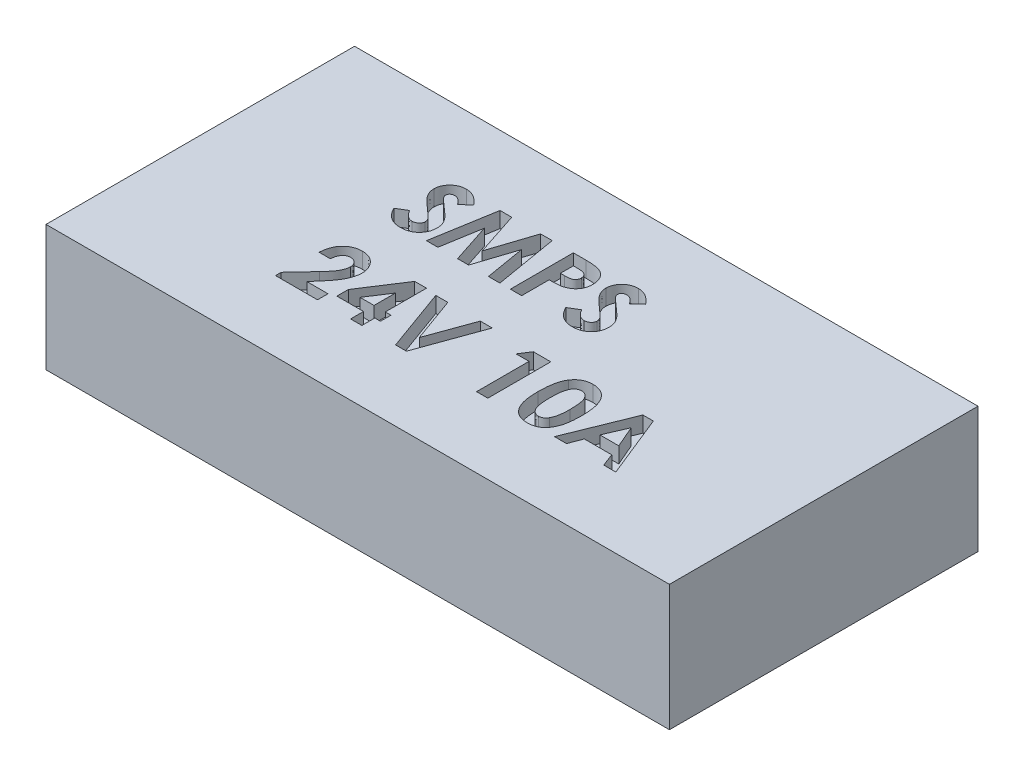
from build123d import *

# Parameters (mm, degrees)
SKIZZE1_W                       = 198
SKIZZE1_H                       = 98
AUFSATZ_LINEAR_AUSTRAGEN1_DEPTH = 40
SCHNITT_LINEAR_AUSTRAGEN1_DEPTH = 5


with BuildPart() as part:
    # Skizze1 → Aufsatz-Linear austragen1 (new body)
    with BuildSketch(Plane(origin=(0, 0, 0), x_dir=(1, 0, 0), z_dir=(0, 1, 0))):
        Rectangle(SKIZZE1_W, SKIZZE1_H)
    extrude(amount=AUFSATZ_LINEAR_AUSTRAGEN1_DEPTH)

    # Skizze2 → Schnitt-Linear austragen1 (cut)
    # profile 1 of 10: a face of its own
    with BuildSketch(Plane(origin=(0, 40, 0), x_dir=(1, 0, 0), z_dir=(0, 1, 0))):
        with BuildLine():
            Line((-36.421271155, 24.25850865), (-39.105566026, 21.802579163))
            add(Edge.make_bspline(
                [(-39.105566026, 21.802579163), (-39.220549709, 21.964775601), (-39.441302344, 22.276170142), (-39.79911934, 22.693134772), (-40.155320609, 23.048836632), (-40.513206139, 23.341789763), (-40.875948091, 23.570214258), (-41.242916798, 23.731941323), (-41.612031812, 23.834752754), (-41.860020124, 23.84755525), (-41.982168591, 23.853861214)],
                knots=[0, 0, 0, 0, 1.299362458, 2.494594718, 3.587462134, 4.587049575, 5.512617175, 6.380583204, 7.202344345, 8, 8, 8, 8], degree=3))
            add(Edge.make_bspline(
                [(-41.982168591, 23.853861214), (-42.096105177, 23.849865466), (-42.31608679, 23.842150727), (-42.6296869, 23.76546679), (-42.908105543, 23.633121577), (-43.151070996, 23.460069076), (-43.343535482, 23.251580934), (-43.497203448, 23.032930479), (-43.583731426, 22.791589825), (-43.59512021, 22.625827329), (-43.600758334, 22.54376506)],
                knots=[0, 0, 0, 0, 1.185010067, 2.2879431, 3.333075148, 4.379039566, 5.372662701, 6.27520591, 7.14612461, 8, 8, 8, 8], degree=3))
            add(Edge.make_bspline(
                [(-43.600758334, 22.54376506), (-43.597225208, 22.460519417), (-43.590109982, 22.292874261), (-43.521386589, 22.047169405), (-43.417800812, 21.807087159), (-43.318820373, 21.660937672), (-43.268226283, 21.586233009)],
                knots=[0, 0, 0, 0, 0.967525499, 1.948461899, 2.951351359, 4, 4, 4, 4], degree=3))
            add(Edge.make_bspline(
                [(-43.268226283, 21.586233009), (-43.222230782, 21.528165857), (-43.116355214, 21.394502941), (-42.914472191, 21.182801717), (-42.660949512, 20.923449187), (-42.346031091, 20.625363725), (-41.982790059, 20.277825012), (-41.554389724, 19.894494927), (-41.073161316, 19.463502181), (-40.731115313, 19.163374441), (-40.551880129, 19.006104804)],
                knots=[0, 0, 0, 0, 0.473873513, 1.090794244, 1.870441696, 2.795289791, 3.865433203, 5.087734844, 6.473946851, 8, 8, 8, 8], degree=3))
            add(Edge.make_bspline(
                [(-40.551880129, 19.006104804), (-40.383642126, 18.860503299), (-40.06436135, 18.584181891), (-39.610088208, 18.19198802), (-39.210857776, 17.839140756), (-38.860854175, 17.530935584), (-38.565383119, 17.264138724), (-38.323202448, 17.037474891), (-38.131354334, 16.855356813), (-38.022299915, 16.745357383), (-37.975758334, 16.698412496)],
                knots=[0, 0, 0, 0, 1.543621617, 2.929473131, 4.163658386, 5.240097082, 6.164993805, 6.925417477, 7.541396219, 8, 8, 8, 8], degree=3))
            add(Edge.make_bspline(
                [(-37.975758334, 16.698412496), (-37.79918928, 16.507326964), (-37.45976155, 16.139993465), (-37.018625156, 15.570742066), (-36.655555635, 15.015036627), (-36.374678169, 14.46242065), (-36.162548209, 13.904920986), (-36.012993778, 13.328864986), (-35.923424633, 12.728233226), (-35.913480367, 12.318375372), (-35.908450642, 12.111072753)],
                knots=[0, 0, 0, 0, 1.206664779, 2.319633467, 3.337109185, 4.282041471, 5.190008762, 6.099243693, 7.03861361, 8, 8, 8, 8], degree=3))
            add(Edge.make_bspline(
                [(-35.908450642, 12.111072753), (-35.912030672, 11.909081773), (-35.919054823, 11.512767953), (-36.00508721, 10.932821711), (-36.127764344, 10.377787988), (-36.317444714, 9.853706334), (-36.548626026, 9.35197411), (-36.838445189, 8.880406708), (-37.178798056, 8.434231673), (-37.568894701, 8.02142493), (-38.000387912, 7.646831422), (-38.46320539, 7.313359435), (-38.961872795, 7.038035833), (-39.492129594, 6.811326485), (-40.05369195, 6.636711914), (-40.645890875, 6.507655472), (-41.269632177, 6.43019783), (-41.696155467, 6.422100552), (-41.914059616, 6.417963778)],
                knots=[0, 0, 0, 0, 1.043214005, 2.046824704, 3.02475056, 3.976699089, 4.921714032, 5.875962561, 6.831408892, 7.817874052, 8.806269674, 9.781291748, 10.760897367, 11.74438705, 12.757449933, 13.795994037, 14.874007457, 16, 16, 16, 16], degree=3))
            add(Edge.make_bspline(
                [(-41.914059616, 6.417963778), (-42.085112518, 6.420998371), (-42.423895362, 6.427008604), (-42.923210056, 6.476077157), (-43.405354837, 6.55526858), (-43.869786613, 6.668773546), (-44.318597731, 6.812599732), (-44.751806622, 6.988277909), (-45.166422702, 7.198531023), (-45.565583153, 7.439035433), (-45.947347562, 7.718292733), (-46.31654319, 8.030593599), (-46.669502836, 8.380741358), (-47.007921693, 8.767907925), (-47.329634463, 9.193189661), (-47.645171959, 9.650663733), (-47.940510746, 10.148820236), (-48.122954652, 10.498281053), (-48.21614295, 10.676777881)],
                knots=[0, 0, 0, 0, 1.016823716, 2.013894106, 2.979844003, 3.91962641, 4.853723003, 5.779685073, 6.695824784, 7.614987388, 8.547259901, 9.504950863, 10.487499108, 11.500346958, 12.559593716, 13.656357062, 14.802919212, 16, 16, 16, 16], degree=3))
            Line((-48.21614295, 10.676777881), (-45.059091667, 12.571809932))
            add(Edge.make_bspline(
                [(-45.059091667, 12.571809932), (-44.942527035, 12.36919271), (-44.719062673, 11.98075818), (-44.34038142, 11.458847157), (-43.952441809, 11.011916757), (-43.546275023, 10.647866506), (-43.126819899, 10.361828581), (-42.69205037, 10.157406037), (-42.241660976, 10.030868713), (-41.934876182, 10.015415583), (-41.781848078, 10.007707368)],
                knots=[0, 0, 0, 0, 1.283663364, 2.460892379, 3.537111102, 4.529833553, 5.449777664, 6.316464042, 7.160231139, 8, 8, 8, 8], degree=3))
            add(Edge.make_bspline(
                [(-41.781848078, 10.007707368), (-41.626196587, 10.014002314), (-41.324210025, 10.026215427), (-40.893162851, 10.139024268), (-40.497962481, 10.316142424), (-40.1563542, 10.568865608), (-39.867101846, 10.860546573), (-39.653617005, 11.185054984), (-39.519504389, 11.536165252), (-39.505325434, 11.780069539), (-39.498194232, 11.902739419)],
                knots=[0, 0, 0, 0, 1.13588714, 2.203786484, 3.234766741, 4.283437687, 5.291419208, 6.222934724, 7.106237994, 8, 8, 8, 8], degree=3))
            add(Edge.make_bspline(
                [(-39.498194232, 11.902739419), (-39.504779605, 12.016863781), (-39.51815716, 12.248696496), (-39.616692107, 12.593394465), (-39.770732285, 12.937935672), (-39.952972678, 13.220537691), (-40.138425097, 13.457152701), (-40.315759439, 13.662168904), (-40.531705756, 13.888675917), (-40.785716505, 14.136958667), (-41.07443554, 14.409202852), (-41.398106071, 14.705381812), (-41.760434466, 15.022886564), (-42.01652889, 15.239167664), (-42.150437821, 15.35225865)],
                knots=[0, 0, 0, 0, 0.916159276, 1.861089862, 2.860218735, 3.940849679, 4.552606315, 5.27541173, 6.11797699, 7.06649574, 8.129236253, 9.306560635, 10.591630461, 12, 12, 12, 12], degree=3))
            add(Edge.make_bspline(
                [(-42.150437821, 15.35225865), (-42.405004029, 15.567646073), (-42.893593634, 15.98103973), (-43.584032734, 16.591609149), (-44.206180183, 17.162242216), (-44.75466245, 17.699993205), (-45.236468046, 18.1949311), (-45.648333974, 18.651075976), (-45.9857357, 19.071946369), (-46.340778264, 19.570439184), (-46.678139686, 20.177886932), (-46.969715689, 20.908716991), (-47.158877893, 21.639454319), (-47.180070887, 22.130031113), (-47.190501924, 22.371489419)],
                knots=[0, 0, 0, 0, 1.345494975, 2.582412109, 3.71882943, 4.751509156, 5.681369928, 6.505683931, 7.230279997, 7.856715994, 8.973648664, 10.023341002, 11.027102913, 12, 12, 12, 12], degree=3))
            add(Edge.make_bspline(
                [(-47.190501924, 22.371489419), (-47.18616367, 22.54271869), (-47.177616843, 22.880058747), (-47.10137783, 23.376068148), (-46.98743572, 23.854675544), (-46.821959064, 24.314134757), (-46.607190346, 24.753870295), (-46.34636208, 25.176034849), (-46.035424098, 25.576742913), (-45.685017983, 25.955728844), (-45.298960158, 26.302078857), (-44.886408312, 26.607767447), (-44.449697523, 26.865956476), (-43.991499368, 27.080143023), (-43.508974583, 27.244089218), (-43.005677907, 27.360302453), (-42.480887451, 27.429422379), (-42.123936311, 27.438818431), (-41.942104488, 27.443604804)],
                knots=[0, 0, 0, 0, 1.010766082, 1.991317756, 2.957454644, 3.913069143, 4.869106762, 5.843196583, 6.838735724, 7.860187025, 8.887984031, 9.89767229, 10.887916223, 11.879572884, 12.879850636, 13.892031539, 14.926195476, 16, 16, 16, 16], degree=3))
            add(Edge.make_bspline(
                [(-41.942104488, 27.443604804), (-41.706459444, 27.434984406), (-41.237029457, 27.417811657), (-40.542963681, 27.283526371), (-39.86502925, 27.072348613), (-39.31873698, 26.817585882), (-38.884062418, 26.570797104), (-38.55092497, 26.343585085), (-38.211939686, 26.083301505), (-37.864372858, 25.789126142), (-37.514682818, 25.455516346), (-37.152926204, 25.09041396), (-36.784032393, 24.690663647), (-36.544309905, 24.405083877), (-36.421271155, 24.25850865)],
                knots=[0, 0, 0, 0, 1.282922637, 2.555718331, 3.837320111, 5.142675274, 5.830281639, 6.55870424, 7.337177975, 8.157850921, 9.037902056, 9.96903443, 10.957596896, 12, 12, 12, 12], degree=3))
        make_face()
    # profile 2 of 10: a face of its own
    with BuildSketch(Plane(origin=(0, 40, 0), x_dir=(1, 0, 0), z_dir=(0, 1, 0))):
        Polygon((-30.736175001, 26.930784291), (-27.010213462, 26.930784291), (-22.44691218, 12.980463778), (-17.851559616, 26.930784291), (-14.16165577, 26.930784291), (-10.780245514, 6.930784291), (-14.414059616, 6.930784291), (-16.549476283, 19.56299583), (-20.708130129, 6.930784291), (-24.209732693, 6.930784291), (-28.344348078, 19.56299583), (-30.475758334, 6.930784291), (-34.113578847, 6.930784291), align=None)
    # profile 3 of 10: a face of its own
    with BuildSketch(Plane(origin=(0, 40, 0), x_dir=(1, 0, 0), z_dir=(0, 1, 0))):
        with BuildLine():
            Line((-7.44691218, 26.930784291), (-3.440501924, 26.930784291))
            add(Edge.make_bspline(
                [(-3.440501924, 26.930784291), (-3.178728275, 26.929612537), (-2.673712036, 26.927351976), (-1.945437069, 26.899939677), (-1.273567754, 26.850815167), (-0.658258451, 26.790105042), (-0.099762161, 26.704991809), (0.402620522, 26.607416151), (0.848993853, 26.4885406), (1.244391357, 26.347436969), (1.599247844, 26.181081301), (1.935056533, 26.003900641), (2.24422811, 25.792441771), (2.542367398, 25.569494831), (2.81242926, 25.313761786), (3.071261773, 25.042262041), (3.307902672, 24.744228139), (3.523448465, 24.423267701), (3.718981712, 24.085310702), (3.889812637, 23.729752977), (4.028381117, 23.356031892), (4.144622841, 22.966564997), (4.237989327, 22.561369267), (4.300137032, 22.137952711), (4.34235088, 21.699271785), (4.346075669, 21.400705271), (4.347959615, 21.249694548)],
                knots=[0, 0, 0, 0, 1.698747864, 3.27724071, 4.728299578, 6.070144658, 7.288476769, 8.393259625, 9.389771311, 10.283485332, 11.113357557, 11.931608583, 12.74405601, 13.541433047, 14.344816069, 15.154114104, 15.974336324, 16.810834471, 17.661136416, 18.50621059, 19.367396281, 20.244825668, 21.142564693, 22.063065223, 23.020325768, 24, 24, 24, 24], degree=3))
            add(Edge.make_bspline(
                [(4.347959615, 21.249694548), (4.345233781, 21.08263498), (4.339877183, 20.754342401), (4.287365261, 20.273105758), (4.197658308, 19.814290188), (4.080416012, 19.37402642), (3.916929968, 18.959557766), (3.73015484, 18.560994879), (3.50036219, 18.189512239), (3.237787351, 17.840463044), (2.951025671, 17.51100936), (2.63326944, 17.21066354), (2.290575228, 16.937378135), (1.924926771, 16.688289094), (1.534951312, 16.463898885), (1.12093024, 16.262106332), (0.680036383, 16.089365387), (0.373011166, 15.999023271), (0.21735064, 15.953220189)],
                knots=[0, 0, 0, 0, 1.102006807, 2.165578795, 3.188629044, 4.184801286, 5.166646146, 6.124351954, 7.085497154, 8.042432466, 9.003981491, 9.963833307, 10.922997304, 11.89326795, 12.880200226, 13.889073926, 14.929769137, 16, 16, 16, 16], degree=3))
            add(Edge.make_bspline(
                [(0.21735064, 15.953220189), (0.114823664, 15.927711311), (-0.107282783, 15.872450867), (-0.474807948, 15.816347647), (-0.898342113, 15.764764186), (-1.37925484, 15.720434446), (-1.917823386, 15.690300552), (-2.513526278, 15.666767321), (-3.166633477, 15.649656231), (-3.620778397, 15.649049055), (-3.857168591, 15.648733009)],
                knots=[0, 0, 0, 0, 0.618981996, 1.340914327, 2.176866532, 3.120127938, 4.170906482, 5.338178032, 6.614476169, 8, 8, 8, 8], degree=3))
            Line((-3.857168591, 15.648733009), (-3.857168591, 6.930784291))
            Line((-3.857168591, 6.930784291), (-7.44691218, 6.930784291))
            Line((-7.44691218, 6.930784291), (-7.44691218, 26.930784291))
        make_face()
        with BuildLine():
            Line((-3.857168591, 19.238476599), (-2.587136539, 19.238476599))
            add(Edge.make_bspline(
                [(-2.587136539, 19.238476599), (-2.356034157, 19.239941967), (-1.930802339, 19.242638267), (-1.35008584, 19.281628329), (-0.883410891, 19.341174029), (-0.514729015, 19.426576334), (-0.223619753, 19.556185641), (0.027443759, 19.706119202), (0.242787344, 19.895706074), (0.429243192, 20.112341514), (0.578309024, 20.361266492), (0.681678414, 20.63842775), (0.748825138, 20.93800183), (0.755026761, 21.146485562), (0.758216025, 21.253700958)],
                knots=[0, 0, 0, 0, 1.8619151, 3.425951444, 4.686033666, 5.651700536, 6.461346321, 7.243864085, 7.999046032, 8.762387399, 9.539336099, 10.322741239, 11.137448474, 12, 12, 12, 12], degree=3))
            add(Edge.make_bspline(
                [(0.758216025, 21.253700958), (0.755059567, 21.347373652), (0.748935281, 21.529121202), (0.703944607, 21.791427997), (0.632242413, 22.035952041), (0.528348692, 22.260139605), (0.39403871, 22.463609758), (0.230287663, 22.646282345), (0.039196798, 22.812069456), (-0.108336523, 22.899823106), (-0.183290385, 22.944406086)],
                knots=[0, 0, 0, 0, 1.102301479, 2.1387299, 3.123554645, 4.094223062, 5.036071848, 5.982632524, 6.975082478, 8, 8, 8, 8], degree=3))
            add(Edge.make_bspline(
                [(-0.183290385, 22.944406086), (-0.246780634, 22.976514925), (-0.381202501, 23.044495918), (-0.610135972, 23.123528792), (-0.874321702, 23.190201728), (-1.175543242, 23.245539621), (-1.512598933, 23.288487573), (-1.885428638, 23.321332012), (-2.294581012, 23.33454004), (-2.579122006, 23.338814048), (-2.727360898, 23.341040701)],
                knots=[0, 0, 0, 0, 0.656809284, 1.390599849, 2.23162475, 3.173112763, 4.218524733, 5.370385145, 6.63003504, 8, 8, 8, 8], degree=3))
            Line((-2.727360898, 23.341040701), (-3.857168591, 23.341040701))
            Line((-3.857168591, 23.341040701), (-3.857168591, 19.238476599))
        make_face(mode=Mode.SUBTRACT)
    # profile 4 of 10: a face of its own
    with BuildSketch(Plane(origin=(0, 40, 0), x_dir=(1, 0, 0), z_dir=(0, 1, 0))):
        with BuildLine():
            Line((18.194113461, 24.25850865), (15.509818589, 21.802579163))
            add(Edge.make_bspline(
                [(15.509818589, 21.802579163), (15.394834907, 21.964775601), (15.174082271, 22.276170142), (14.816265275, 22.693134772), (14.460064006, 23.048836632), (14.102178476, 23.341789763), (13.739436524, 23.570214258), (13.372467817, 23.731941323), (13.003352803, 23.834752754), (12.755364492, 23.84755525), (12.633216025, 23.853861214)],
                knots=[0, 0, 0, 0, 1.299362458, 2.494594718, 3.587462134, 4.587049575, 5.512617175, 6.380583204, 7.202344345, 8, 8, 8, 8], degree=3))
            add(Edge.make_bspline(
                [(12.633216025, 23.853861214), (12.519279439, 23.849865466), (12.299297825, 23.842150727), (11.985697716, 23.76546679), (11.707279072, 23.633121577), (11.464313619, 23.460069076), (11.271849134, 23.251580934), (11.118181167, 23.032930479), (11.031653189, 22.791589825), (11.020264405, 22.625827329), (11.014626281, 22.54376506)],
                knots=[0, 0, 0, 0, 1.185010067, 2.2879431, 3.333075148, 4.379039566, 5.372662701, 6.27520591, 7.14612461, 8, 8, 8, 8], degree=3))
            add(Edge.make_bspline(
                [(11.014626281, 22.54376506), (11.018159408, 22.460519417), (11.025274633, 22.292874261), (11.093998027, 22.047169405), (11.197583804, 21.807087159), (11.296564243, 21.660937672), (11.347158333, 21.586233009)],
                knots=[0, 0, 0, 0, 0.967525499, 1.948461899, 2.951351359, 4, 4, 4, 4], degree=3))
            add(Edge.make_bspline(
                [(11.347158333, 21.586233009), (11.393153833, 21.528165857), (11.499029401, 21.394502941), (11.700912425, 21.182801717), (11.954435104, 20.923449187), (12.269353524, 20.625363725), (12.632594556, 20.277825012), (13.060994891, 19.894494927), (13.542223299, 19.463502181), (13.884269303, 19.163374441), (14.063504486, 19.006104804)],
                knots=[0, 0, 0, 0, 0.473873513, 1.090794244, 1.870441696, 2.795289791, 3.865433203, 5.087734844, 6.473946851, 8, 8, 8, 8], degree=3))
            add(Edge.make_bspline(
                [(14.063504486, 19.006104804), (14.231742489, 18.860503299), (14.551023265, 18.584181891), (15.005296407, 18.19198802), (15.40452684, 17.839140756), (15.754530441, 17.530935584), (16.050001496, 17.264138724), (16.292182167, 17.037474891), (16.484030281, 16.855356813), (16.593084701, 16.745357383), (16.639626281, 16.698412496)],
                knots=[0, 0, 0, 0, 1.543621617, 2.929473131, 4.163658386, 5.240097082, 6.164993805, 6.925417477, 7.541396219, 8, 8, 8, 8], degree=3))
            add(Edge.make_bspline(
                [(16.639626281, 16.698412496), (16.816195335, 16.507326964), (17.155623066, 16.139993465), (17.596759459, 15.570742066), (17.95982898, 15.015036627), (18.240706447, 14.46242065), (18.452836406, 13.904920986), (18.602390838, 13.328864986), (18.691959982, 12.728233226), (18.701904248, 12.318375372), (18.706933974, 12.111072753)],
                knots=[0, 0, 0, 0, 1.206664779, 2.319633467, 3.337109185, 4.282041471, 5.190008762, 6.099243693, 7.03861361, 8, 8, 8, 8], degree=3))
            add(Edge.make_bspline(
                [(18.706933974, 12.111072753), (18.703353944, 11.909081773), (18.696329792, 11.512767953), (18.610297406, 10.932821711), (18.487620272, 10.377787988), (18.297939902, 9.853706334), (18.06675859, 9.35197411), (17.776939426, 8.880406708), (17.436586559, 8.434231673), (17.046489914, 8.02142493), (16.614996703, 7.646831422), (16.152179226, 7.313359435), (15.65351182, 7.038035833), (15.123255022, 6.811326485), (14.561692665, 6.636711914), (13.96949374, 6.507655472), (13.345752439, 6.43019783), (12.919229148, 6.422100552), (12.701324999, 6.417963778)],
                knots=[0, 0, 0, 0, 1.043214005, 2.046824704, 3.02475056, 3.976699089, 4.921714032, 5.875962561, 6.831408892, 7.817874052, 8.806269674, 9.781291748, 10.760897367, 11.74438705, 12.757449933, 13.795994037, 14.874007457, 16, 16, 16, 16], degree=3))
            add(Edge.make_bspline(
                [(12.701324999, 6.417963778), (12.530272098, 6.420998371), (12.191489254, 6.427008604), (11.69217456, 6.476077157), (11.210029778, 6.55526858), (10.745598002, 6.668773546), (10.296786884, 6.812599732), (9.863577993, 6.988277909), (9.448961913, 7.198531023), (9.049801462, 7.439035433), (8.668037053, 7.718292733), (8.298841425, 8.030593599), (7.945881779, 8.380741358), (7.607462922, 8.767907925), (7.285750152, 9.193189661), (6.970212656, 9.650663733), (6.674873869, 10.148820236), (6.492429963, 10.498281053), (6.399241666, 10.676777881)],
                knots=[0, 0, 0, 0, 1.016823716, 2.013894106, 2.979844003, 3.91962641, 4.853723003, 5.779685073, 6.695824784, 7.614987388, 8.547259901, 9.504950863, 10.487499108, 11.500346958, 12.559593716, 13.656357062, 14.802919212, 16, 16, 16, 16], degree=3))
            Line((6.399241666, 10.676777881), (9.556292948, 12.571809932))
            add(Edge.make_bspline(
                [(9.556292948, 12.571809932), (9.67285758, 12.36919271), (9.896321942, 11.98075818), (10.275003195, 11.458847157), (10.662942806, 11.011916757), (11.069109592, 10.647866506), (11.488564717, 10.361828581), (11.923334245, 10.157406037), (12.373723639, 10.030868713), (12.680508433, 10.015415583), (12.833536538, 10.007707368)],
                knots=[0, 0, 0, 0, 1.283663364, 2.460892379, 3.537111102, 4.529833553, 5.449777664, 6.316464042, 7.160231139, 8, 8, 8, 8], degree=3))
            add(Edge.make_bspline(
                [(12.833536538, 10.007707368), (12.989188029, 10.014002314), (13.291174591, 10.026215427), (13.722221764, 10.139024268), (14.117422134, 10.316142424), (14.459030416, 10.568865608), (14.74828277, 10.860546573), (14.96176761, 11.185054984), (15.095880227, 11.536165252), (15.110059182, 11.780069539), (15.117190384, 11.902739419)],
                knots=[0, 0, 0, 0, 1.13588714, 2.203786484, 3.234766741, 4.283437687, 5.291419208, 6.222934724, 7.106237994, 8, 8, 8, 8], degree=3))
            add(Edge.make_bspline(
                [(15.117190384, 11.902739419), (15.110605011, 12.016863781), (15.097227456, 12.248696496), (14.998692508, 12.593394465), (14.84465233, 12.937935672), (14.662411938, 13.220537691), (14.476959518, 13.457152701), (14.299625177, 13.662168904), (14.083678859, 13.888675917), (13.82966811, 14.136958667), (13.540949075, 14.409202852), (13.217278545, 14.705381812), (12.85495015, 15.022886564), (12.598855725, 15.239167664), (12.464946794, 15.35225865)],
                knots=[0, 0, 0, 0, 0.916159276, 1.861089862, 2.860218735, 3.940849679, 4.552606315, 5.27541173, 6.11797699, 7.06649574, 8.129236253, 9.306560635, 10.591630461, 12, 12, 12, 12], degree=3))
            add(Edge.make_bspline(
                [(12.464946794, 15.35225865), (12.210380586, 15.567646073), (11.721790981, 15.98103973), (11.031351882, 16.591609149), (10.409204432, 17.162242216), (9.860722165, 17.699993205), (9.37891657, 18.1949311), (8.967050641, 18.651075976), (8.629648915, 19.071946369), (8.274606352, 19.570439184), (7.93724493, 20.177886932), (7.645668927, 20.908716991), (7.456506722, 21.639454319), (7.435313728, 22.130031113), (7.424882691, 22.371489419)],
                knots=[0, 0, 0, 0, 1.345494975, 2.582412109, 3.71882943, 4.751509156, 5.681369928, 6.505683931, 7.230279997, 7.856715994, 8.973648664, 10.023341002, 11.027102913, 12, 12, 12, 12], degree=3))
            add(Edge.make_bspline(
                [(7.424882691, 22.371489419), (7.429220946, 22.54271869), (7.437767772, 22.880058747), (7.514006786, 23.376068148), (7.627948896, 23.854675544), (7.793425551, 24.314134757), (8.008194269, 24.753870295), (8.269022535, 25.176034849), (8.579960518, 25.576742913), (8.930366633, 25.955728844), (9.316424457, 26.302078857), (9.728976304, 26.607767447), (10.165687092, 26.865956476), (10.623885247, 27.080143023), (11.106410032, 27.244089218), (11.609706708, 27.360302453), (12.134497164, 27.429422379), (12.491448304, 27.438818431), (12.673280127, 27.443604804)],
                knots=[0, 0, 0, 0, 1.010766082, 1.991317756, 2.957454644, 3.913069143, 4.869106762, 5.843196583, 6.838735724, 7.860187025, 8.887984031, 9.89767229, 10.887916223, 11.879572884, 12.879850636, 13.892031539, 14.926195476, 16, 16, 16, 16], degree=3))
            add(Edge.make_bspline(
                [(12.673280127, 27.443604804), (12.908925171, 27.434984406), (13.378355158, 27.417811657), (14.072420934, 27.283526371), (14.750355366, 27.072348613), (15.296647635, 26.817585882), (15.731322197, 26.570797104), (16.064459645, 26.343585085), (16.40344493, 26.083301505), (16.751011757, 25.789126142), (17.100701798, 25.455516346), (17.462458412, 25.09041396), (17.831352223, 24.690663647), (18.071074711, 24.405083877), (18.194113461, 24.25850865)],
                knots=[0, 0, 0, 0, 1.282922637, 2.555718331, 3.837320111, 5.142675274, 5.830281639, 6.55870424, 7.337177975, 8.157850921, 9.037902056, 9.96903443, 10.957596896, 12, 12, 12, 12], degree=3))
        make_face()
    # profile 5 of 10: a face of its own
    with BuildSketch(Plane(origin=(0, 40, 0), x_dir=(1, 0, 0), z_dir=(0, 1, 0))):
        with BuildLine():
            Line((-44.369989103, -13.29998494), (-47.959732693, -13.29998494))
            add(Edge.make_bspline(
                [(-47.959732693, -13.29998494), (-47.944229141, -13.028439828), (-47.913936131, -12.497856984), (-47.793438195, -11.727168414), (-47.631975095, -10.998952464), (-47.416481154, -10.315756512), (-47.145698917, -9.67782881), (-46.826596309, -9.082994627), (-46.451020983, -8.534385779), (-46.026966417, -8.034647967), (-45.561631891, -7.586328565), (-45.064678207, -7.188820418), (-44.528503788, -6.860806699), (-43.962904981, -6.590881777), (-43.367978093, -6.375224306), (-42.738094184, -6.231039836), (-42.078707128, -6.1333967), (-41.627303293, -6.124852534), (-41.397232693, -6.12049776)],
                knots=[0, 0, 0, 0, 1.199038563, 2.342849363, 3.436047546, 4.486744587, 5.497670872, 6.488682221, 7.459191391, 8.424610317, 9.374430501, 10.305433194, 11.225809216, 12.140057399, 13.06607119, 14.010487599, 14.985989317, 16, 16, 16, 16], degree=3))
            add(Edge.make_bspline(
                [(-41.397232693, -6.12049776), (-41.114824296, -6.129309647), (-40.563496923, -6.146512514), (-39.762374518, -6.293258683), (-39.014213785, -6.538714327), (-38.319558565, -6.881680594), (-37.68432258, -7.317383286), (-37.108611169, -7.836887437), (-36.609834765, -8.451092519), (-36.184830977, -9.134442459), (-35.831703624, -9.858013872), (-35.584246685, -10.606216719), (-35.421595902, -11.359196729), (-35.404248189, -11.866215356), (-35.395630129, -12.118093914)],
                knots=[0, 0, 0, 0, 1.075374347, 2.099382735, 3.09057751, 4.06680945, 5.040638231, 6.016817125, 7.011024321, 8.044445721, 9.0776792, 10.070479129, 11.0414456, 12, 12, 12, 12], degree=3))
            add(Edge.make_bspline(
                [(-35.395630129, -12.118093914), (-35.398985546, -12.270447868), (-35.405739173, -12.577098744), (-35.452698034, -13.041136783), (-35.523145606, -13.513813778), (-35.629363375, -13.994724453), (-35.761825641, -14.484003615), (-35.922521516, -14.983115508), (-36.115178499, -15.489230351), (-36.336581536, -16.00804438), (-36.600715919, -16.541241981), (-36.908263694, -17.096815993), (-37.267387876, -17.674273579), (-37.673750696, -18.276875252), (-38.129325762, -18.903670616), (-38.636337041, -19.552771568), (-39.188944953, -20.226465332), (-39.581146335, -20.676791807), (-39.78264936, -20.908158017)],
                knots=[0, 0, 0, 0, 0.728284026, 1.46585585, 2.227944881, 3.01186502, 3.81876927, 4.650621989, 5.517437689, 6.406905708, 7.346299482, 8.360816762, 9.441613733, 10.596154504, 11.834900912, 13.145207542, 14.533280747, 16, 16, 16, 16], degree=3))
            Line((-39.78264936, -20.908158017), (-41.869989103, -23.29998494))
            Line((-41.869989103, -23.29998494), (-35.139219873, -23.29998494))
            Line((-35.139219873, -23.29998494), (-35.139219873, -26.633318273))
            Line((-35.139219873, -26.633318273), (-48.472553206, -26.633318273))
            Line((-48.472553206, -26.633318273), (-48.472553206, -24.814408017))
            Line((-48.472553206, -24.814408017), (-42.551078847, -18.512324683))
            add(Edge.make_bspline(
                [(-42.551078847, -18.512324683), (-42.379636947, -18.328490955), (-42.04760483, -17.972459541), (-41.575157344, -17.449589533), (-41.147634103, -16.953398375), (-40.77390015, -16.478602634), (-40.434342406, -16.040602751), (-40.144101725, -15.626196863), (-39.900522633, -15.239131348), (-39.636082981, -14.772397938), (-39.384952239, -14.215735292), (-39.154524584, -13.574437098), (-39.014062982, -12.961503719), (-38.994674839, -12.562103155), (-38.985373719, -12.37049776)],
                knots=[0, 0, 0, 0, 1.246127091, 2.413378631, 3.493388633, 4.492180848, 5.408488754, 6.240484944, 6.999099869, 7.674939598, 8.898438119, 10.020720584, 11.050475521, 12, 12, 12, 12], degree=3))
            add(Edge.make_bspline(
                [(-38.985373719, -12.37049776), (-38.992327942, -12.185134323), (-39.005802864, -11.825962945), (-39.15388134, -11.315043573), (-39.383289651, -10.852458236), (-39.70655836, -10.452029508), (-40.098138014, -10.12297067), (-40.550645086, -9.87822595), (-41.060390313, -9.737009369), (-41.41773143, -9.719334099), (-41.601559616, -9.71024135)],
                knots=[0, 0, 0, 0, 1.062038974, 2.057870785, 3.028805853, 4.01125022, 4.991535629, 5.949134679, 6.94496649, 8, 8, 8, 8], degree=3))
            add(Edge.make_bspline(
                [(-41.601559616, -9.71024135), (-41.696527599, -9.71360032), (-41.883487324, -9.720212993), (-42.158303506, -9.764231764), (-42.419810848, -9.841810254), (-42.670920071, -9.945754512), (-42.908951272, -10.083533372), (-43.133304061, -10.253367767), (-43.346342277, -10.450941821), (-43.547088842, -10.675637745), (-43.729794423, -10.926398461), (-43.892072852, -11.200933785), (-44.026250097, -11.499073303), (-44.144384621, -11.816881118), (-44.235495618, -12.157770746), (-44.301835727, -12.519702), (-44.352269682, -12.902086066), (-44.36397518, -13.164939154), (-44.369989103, -13.29998494)],
                knots=[0, 0, 0, 0, 0.903469896, 1.778625579, 2.63899355, 3.493148037, 4.358286772, 5.247621495, 6.164656832, 7.118446693, 8.109501108, 9.111810964, 10.146451449, 11.215617525, 12.33435995, 13.498009769, 14.714554818, 16, 16, 16, 16], degree=3))
        make_face()
    # profile 6 of 10: a face of its own
    with BuildSketch(Plane(origin=(0, 40, 0), x_dir=(1, 0, 0), z_dir=(0, 1, 0))):
        Polygon((-24.77864295, -6.12049776), (-21.03665577, -6.12049776), (-21.03665577, -19.197420837), (-19.241783975, -19.197420837), (-19.241783975, -22.53075417), (-21.03665577, -22.53075417), (-21.03665577, -26.633318273), (-24.62639936, -26.633318273), (-24.62639936, -22.53075417), (-33.087937821, -22.53075417), (-33.087937821, -18.896940068), align=None)
        Polygon((-24.62639936, -19.197420837), (-24.62639936, -12.390529811), (-29.053482693, -19.197420837), align=None, mode=Mode.SUBTRACT)
    # profile 7 of 10: a face of its own
    with BuildSketch(Plane(origin=(0, 40, 0), x_dir=(1, 0, 0), z_dir=(0, 1, 0))):
        Polygon((-17.575117309, -6.633318273), (-13.740982693, -6.633318273), (-8.600758334, -20.840049042), (-3.448514744, -6.633318273), (0.37360064, -6.633318273), (-6.878001924, -26.633318273), (-10.335533975, -26.633318273), align=None)
    # profile 8 of 10: a face of its own
    with BuildSketch(Plane(origin=(0, 40, 0), x_dir=(1, 0, 0), z_dir=(0, 1, 0))):
        Polygon((13.414466025, -6.633318273), (18.96334423, -6.633318273), (18.96334423, -26.633318273), (15.37360064, -26.633318273), (15.37360064, -9.966651606), (11.271036538, -9.966651606), align=None)
    # profile 9 of 10: a face of its own
    with BuildSketch(Plane(origin=(0, 40, 0), x_dir=(1, 0, 0), z_dir=(0, 1, 0))):
        with BuildLine():
            add(Edge.make_bspline(
                [(31.851966025, -6.12049776), (32.025724514, -6.123077254), (32.367380128, -6.128149228), (32.870574536, -6.183082836), (33.355289876, -6.266072198), (33.823422413, -6.381813419), (34.271602483, -6.534992803), (34.703092033, -6.718345899), (35.112755088, -6.941489955), (35.505816161, -7.193542628), (35.882123846, -7.478901984), (36.232633849, -7.804226385), (36.563747228, -8.162030101), (36.868296599, -8.557722484), (37.153026298, -8.987704291), (37.417000754, -9.452043704), (37.658199175, -9.953013354), (37.87932482, -10.491517279), (38.077056071, -11.075627421), (38.243604858, -11.712043778), (38.386448312, -12.400911684), (38.507018266, -13.143945838), (38.598149664, -13.942133909), (38.65957406, -14.794945621), (38.701726389, -15.700736878), (38.705166568, -16.322102237), (38.706933974, -16.641331093)],
                knots=[0, 0, 0, 0, 0.879237366, 1.728815576, 2.559023295, 3.367336655, 4.166867292, 4.954216142, 5.737608147, 6.525189134, 7.316157332, 8.124696809, 8.942788509, 9.781158001, 10.649253743, 11.551476218, 12.482711956, 13.461909668, 14.496590415, 15.601789533, 16.789733467, 18.056700938, 19.410929216, 20.8549011, 22.384193279, 24, 24, 24, 24], degree=3))
            add(Edge.make_bspline(
                [(38.706933974, -16.641331093), (38.705023886, -16.964553862), (38.70131262, -17.592569902), (38.661326345, -18.506645986), (38.592468091, -19.365649622), (38.503718603, -20.169491942), (38.382156081, -20.917748449), (38.23978947, -21.612356623), (38.07061176, -22.253064687), (37.866367305, -22.838428989), (37.646580138, -23.377878645), (37.404721936, -23.877871523), (37.145008253, -24.33976188), (36.873396138, -24.77051796), (36.574994815, -25.157441293), (36.26432832, -25.513689296), (35.927869677, -25.825692025), (35.579785095, -26.109528701), (35.20732283, -26.354820549), (34.814323987, -26.569348755), (34.393782078, -26.74335661), (33.953362866, -26.894699348), (33.485559319, -27.003347104), (32.997804769, -27.089555528), (32.484592566, -27.137199591), (32.135177027, -27.143110151), (31.956132691, -27.146138786)],
                knots=[0, 0, 0, 0, 1.643780988, 3.193836972, 4.651895693, 6.025988579, 7.305620092, 8.505800249, 9.631074763, 10.672816429, 11.65661981, 12.592235626, 13.49536222, 14.350718032, 15.179365177, 15.97804903, 16.751647189, 17.51006938, 18.259804725, 19.016521909, 19.783502495, 20.571750527, 21.382245291, 22.22305063, 23.089471752, 24, 24, 24, 24], degree=3))
            add(Edge.make_bspline(
                [(31.956132691, -27.146138786), (31.777093189, -27.14305173), (31.426357436, -27.137004234), (30.911757457, -27.089909782), (30.421418053, -27.002997872), (29.949913427, -26.893865231), (29.500525178, -26.743691471), (29.071098502, -26.564477426), (28.66493532, -26.351287769), (28.280911029, -26.105424414), (27.920336797, -25.82348682), (27.577609303, -25.508490627), (27.253486679, -25.161234269), (26.952899636, -24.777828186), (26.670925427, -24.363390052), (26.410504596, -23.913187183), (26.17179365, -23.427875065), (25.947325667, -22.906777222), (25.752291403, -22.338675015), (25.578719964, -21.718495363), (25.436534807, -21.041068559), (25.322179989, -20.306612232), (25.230879168, -19.51668236), (25.162961851, -18.670897666), (25.122753471, -17.768864205), (25.119081126, -17.148851676), (25.117190384, -16.829632376)],
                knots=[0, 0, 0, 0, 0.917216111, 1.796812873, 2.643793957, 3.46689424, 4.273913431, 5.068098542, 5.848489301, 6.620921603, 7.401012384, 8.190319798, 9.003608147, 9.831726257, 10.68377682, 11.569763213, 12.493818149, 13.453288342, 14.474581811, 15.568529029, 16.750744269, 18.018426408, 19.375425659, 20.823733699, 22.36466933, 24, 24, 24, 24], degree=3))
            add(Edge.make_bspline(
                [(25.117190384, -16.829632376), (25.120615286, -16.386102288), (25.127223678, -15.530305271), (25.21097008, -14.293927404), (25.333888558, -13.151110238), (25.514426684, -12.103765424), (25.737659581, -11.148013903), (26.023520929, -10.290151665), (26.348953279, -9.518308262), (26.62626345, -9.061063583), (26.759818589, -8.840850324)],
                knots=[0, 0, 0, 0, 1.288568992, 2.486310467, 3.599230591, 4.627010532, 5.572937695, 6.447898582, 7.252493626, 8, 8, 8, 8], degree=3))
            add(Edge.make_bspline(
                [(26.759818589, -8.840850324), (26.915110143, -8.624512887), (27.218735731, -8.201530569), (27.749633558, -7.646233851), (28.320014152, -7.171316906), (28.941592804, -6.78752753), (29.604538989, -6.484871196), (30.314544438, -6.271108437), (31.068987218, -6.146560292), (31.58707566, -6.129315002), (31.851966025, -6.12049776)],
                knots=[0, 0, 0, 0, 1.058512271, 2.069600068, 3.047294572, 4.004278952, 4.967380941, 5.939006123, 6.946246673, 8, 8, 8, 8], degree=3))
        make_face()
        with BuildLine():
            add(Edge.make_bspline(
                [(31.94010705, -9.71024135), (31.783027936, -9.717686588), (31.475069488, -9.732283206), (31.028207107, -9.8561879), (30.606843782, -10.047565381), (30.286323956, -10.277858258), (30.046418053, -10.498621598), (29.878794079, -10.69840524), (29.717147175, -10.921349387), (29.574372489, -11.17751436), (29.439555916, -11.457695851), (29.307799487, -11.763165714), (29.199793813, -12.101426951), (29.093681102, -12.46671893), (29.000716466, -12.869141002), (28.922832481, -13.311982524), (28.853249986, -13.798123337), (28.804715367, -14.327881861), (28.759466536, -14.90070384), (28.727030032, -15.517865298), (28.713469143, -16.179199739), (28.709158549, -16.634650953), (28.706933974, -16.869696478)],
                knots=[0, 0, 0, 0, 1.076674018, 2.110852608, 3.161083442, 4.239746716, 4.804137807, 5.395870207, 6.026861976, 6.692161227, 7.405688833, 8.16177676, 8.973626916, 9.841385931, 10.773283133, 11.807421078, 12.927755683, 14.143907515, 15.458935494, 16.872852025, 18.386167141, 20, 20, 20, 20], degree=3))
            add(Edge.make_bspline(
                [(28.706933974, -16.869696478), (28.710595355, -17.174209318), (28.717616327, -17.758135266), (28.754388893, -18.597841111), (28.828096451, -19.362041045), (28.919773771, -20.055914335), (29.048538311, -20.674961025), (29.196690249, -21.225037871), (29.379644719, -21.699132731), (29.591083861, -22.104102081), (29.825262239, -22.448608666), (30.079473169, -22.741440814), (30.34506168, -22.995019639), (30.630317654, -23.200998594), (30.934560556, -23.35885137), (31.255250516, -23.472392922), (31.592591328, -23.541896435), (31.823598839, -23.551534338), (31.94010705, -23.556395196)],
                knots=[0, 0, 0, 0, 1.771748488, 3.397459088, 4.888034009, 6.237357457, 7.467047327, 8.564189669, 9.548206622, 10.417051504, 11.216568818, 11.965764335, 12.669334354, 13.348544111, 14.005342236, 14.656555988, 15.322436492, 16, 16, 16, 16], degree=3))
            add(Edge.make_bspline(
                [(31.94010705, -23.556395196), (32.05261707, -23.553069036), (32.272897697, -23.546556827), (32.594116186, -23.47970988), (32.897883214, -23.371031263), (33.183281613, -23.217297729), (33.451332214, -23.021802019), (33.700724951, -22.783685042), (33.929578953, -22.500573326), (34.062910334, -22.290462562), (34.131613461, -22.182196478)],
                knots=[0, 0, 0, 0, 0.992283464, 1.942767638, 2.88273346, 3.832339453, 4.79467288, 5.803907806, 6.868395428, 8, 8, 8, 8], degree=3))
            add(Edge.make_bspline(
                [(34.131613461, -22.182196478), (34.212499821, -22.034254335), (34.38211196, -21.724031658), (34.57838742, -21.200542459), (34.743601163, -20.610133162), (34.885798215, -19.95096636), (34.983052324, -19.220442215), (35.066807445, -18.423193046), (35.107204621, -17.555204227), (35.113775441, -16.953858443), (35.117190384, -16.641331093)],
                knots=[0, 0, 0, 0, 0.710965849, 1.490837728, 2.352621235, 3.297892224, 4.334225155, 5.461620853, 6.680770821, 8, 8, 8, 8], degree=3))
            add(Edge.make_bspline(
                [(35.117190384, -16.641331093), (35.115871265, -16.326090856), (35.113332188, -15.719307214), (35.066747462, -14.848197914), (35.001874673, -14.052584143), (34.906984509, -13.334242181), (34.784891067, -12.69142821), (34.634410438, -12.12418425), (34.457004971, -11.631392372), (34.246623229, -11.213543959), (34.013612379, -10.858430127), (33.766264248, -10.553770005), (33.503532948, -10.293658878), (33.225857851, -10.077117905), (32.926812071, -9.91166436), (32.61210777, -9.79484047), (32.281099782, -9.724165934), (32.055305474, -9.714945527), (31.94010705, -9.71024135)],
                knots=[0, 0, 0, 0, 1.793836731, 3.452829483, 4.963243077, 6.335886805, 7.574563692, 8.684454726, 9.672768357, 10.54971625, 11.340229787, 12.085688095, 12.778991901, 13.440269426, 14.083255152, 14.715733572, 15.344777694, 16, 16, 16, 16], degree=3))
        make_face(mode=Mode.SUBTRACT)
    # profile 10 of 10: a face of its own
    with BuildSketch(Plane(origin=(0, 40, 0), x_dir=(1, 0, 0), z_dir=(0, 1, 0))):
        Polygon((48.198119871, -6.633318273), (51.527446794, -6.633318273), (59.604369871, -26.633318273), (55.770235256, -26.633318273), (54.215748076, -22.53075417), (45.501805768, -22.53075417), (43.947318589, -26.633318273), (40.117190384, -26.633318273), align=None)
        Polygon((49.860780127, -11.997901606), (46.863985256, -18.941010581), (52.857574999, -18.941010581), align=None, mode=Mode.SUBTRACT)
    extrude(amount=-SCHNITT_LINEAR_AUSTRAGEN1_DEPTH, mode=Mode.SUBTRACT)


solid = part.part
